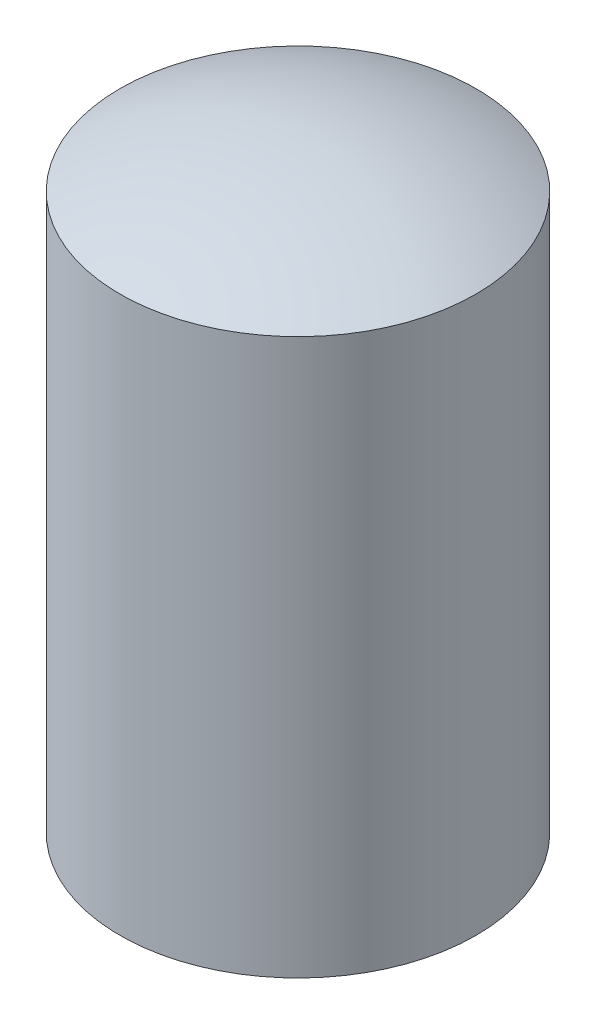
from build123d import *


with BuildPart() as part:
    # Sketch1 → Revolve1 (revolve)
    with BuildSketch(Plane.XY):
        with BuildLine():
            Line((5, -1.2), (5, -16.8))
            ThreePointArc((5, -16.8), (2.570992026, -17.69580011), (0, -18))
            Line((0, -18), (0, 0))
            ThreePointArc((0, 0), (2.570992026, -0.30419989), (5, -1.2))
        make_face()
    revolve(axis=Axis((0, 5, 0), (0, -1, 0)))


solid = part.part
